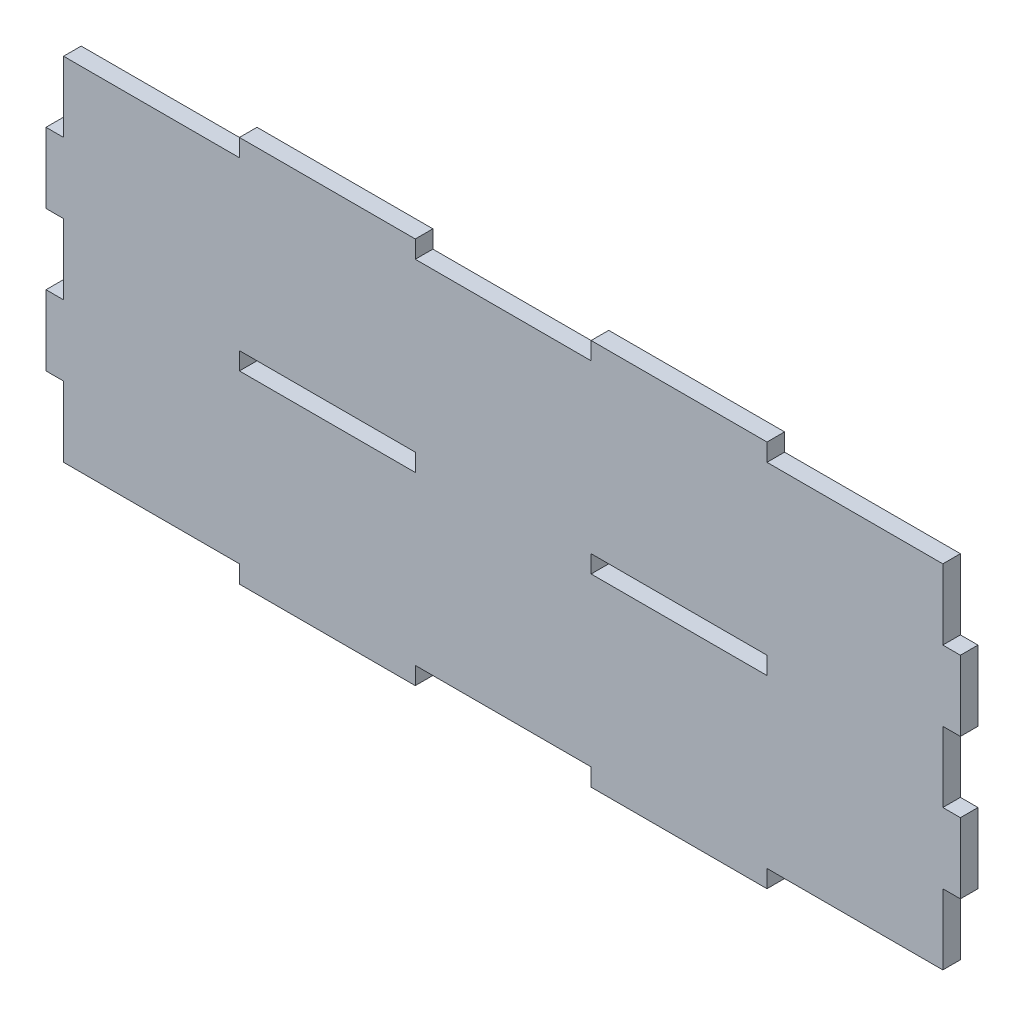
from build123d import *

# Parameters (mm, degrees)
ESBO_O1_W                = 30
ESBO_O1_H                = 3
RESSALTO_EXTRUS_O1_DEPTH = 3


with BuildPart() as part:
    # Esboço1 → Ressalto-extrusão1 (new body)
    with BuildSketch(Plane.XY):
        Polygon((45, 30), (75, 30), (75, 18), (78, 18), (78, 6), (75, 6), (75, -6), (78, -6), (78, -18), (75, -18), (75, -30), (45, -30), (45, -33), (15, -33), (15, -30), (-15, -30), (-15, -33), (-45, -33), (-45, -30), (-75, -30), (-75, -18), (-78, -18), (-78, -6), (-75, -6), (-75, 6), (-78, 6), (-78, 18), (-75, 18), (-75, 30), (-45, 30), (-45, 33), (-15, 33), (-15, 30), (15, 30), (15, 33), (45, 33), align=None)
        with Locations((30, 0)):
            Rectangle(ESBO_O1_W, ESBO_O1_H, mode=Mode.SUBTRACT)
        with Locations((-30, 0)):
            Rectangle(ESBO_O1_W, ESBO_O1_H, mode=Mode.SUBTRACT)
    extrude(amount=RESSALTO_EXTRUS_O1_DEPTH)


solid = part.part
